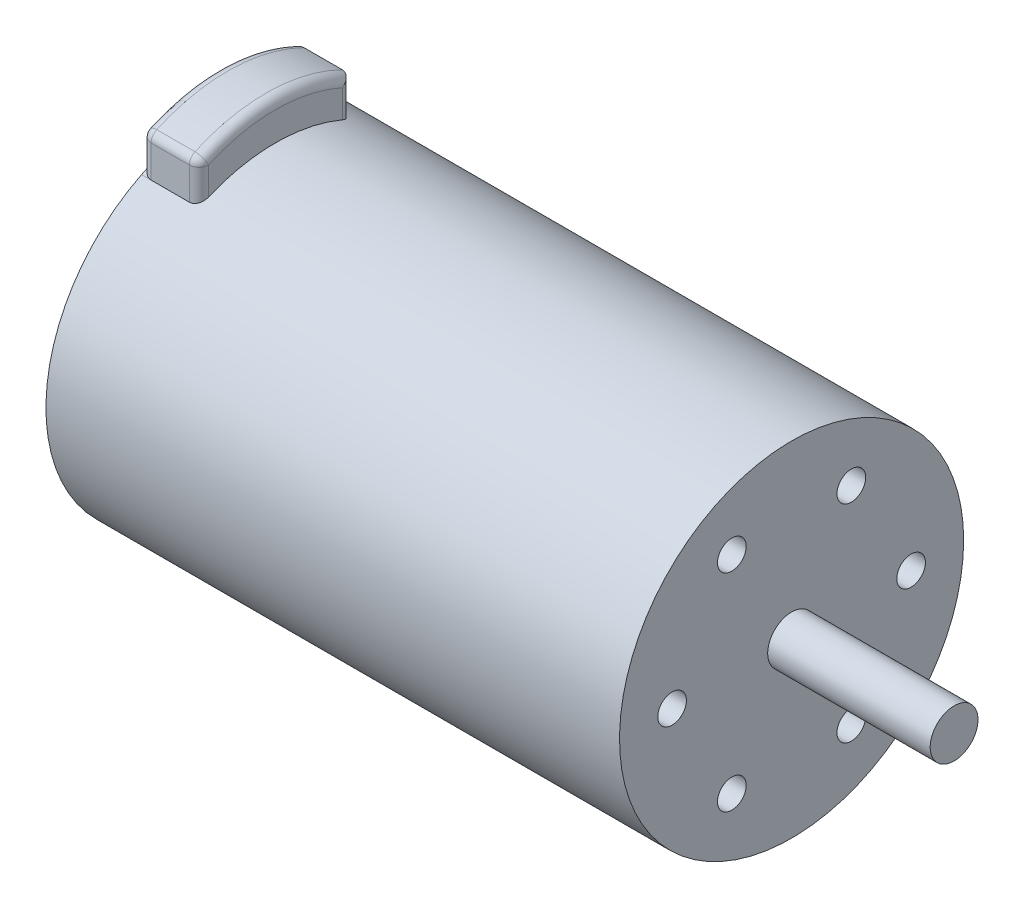
from build123d import *

# Parameters (mm, degrees)
SKETCH1_R           = 18
BOSS_EXTRUDE1_DEPTH = 60
SKETCH2_R           = 2.5
BOSS_EXTRUDE2_DEPTH = 17
SKETCH3_R           = 1.5
CUT_EXTRUDE1_DEPTH  = 5
BOSS_EXTRUDE3_DEPTH = 6
FILLET1_R           = 1


with BuildPart() as part:
    # Sketch1 → Boss-Extrude1 (new body)
    with BuildSketch(Plane(origin=(0, 0, 0), x_dir=(0, 0, -1), z_dir=(1, 0, 0))):
        Circle(SKETCH1_R)
    extrude(amount=BOSS_EXTRUDE1_DEPTH)

    # Sketch2 → Boss-Extrude2 (add)
    with BuildSketch(Plane(origin=(60, 0, 0), x_dir=(0, 0, -1), z_dir=(1, 0, 0))):
        Circle(SKETCH2_R)
    extrude(amount=BOSS_EXTRUDE2_DEPTH)

    # Sketch3 → Cut-Extrude1 (cut)
    with BuildSketch(Plane(origin=(60, 0, 0), x_dir=(0, 0, -1), z_dir=(1, 0, 0))):
        with Locations((12.5, 0)):
            Circle(SKETCH3_R)
        with Locations((6.25, -10.825317547)):
            Circle(SKETCH3_R)
        with Locations((-6.25, -10.825317547)):
            Circle(SKETCH3_R)
        with Locations((-12.5, 0)):
            Circle(SKETCH3_R)
        with Locations((-6.25, 10.825317547)):
            Circle(SKETCH3_R)
        with Locations((6.25, 10.825317547)):
            Circle(SKETCH3_R)
    extrude(amount=-CUT_EXTRUDE1_DEPTH, mode=Mode.SUBTRACT)

    # Sketch4 → Boss-Extrude3 (add)
    with BuildSketch(Plane.ZY):
        with BuildLine():
            Line((-8, 16.124515497), (-8, 20.124515497))
            ThreePointArc((-8, 20.124515497), (0, 22), (8, 20.124515497))
            Line((8, 20.124515497), (8, 16.124515497))
            ThreePointArc((8, 16.124515497), (0, 18), (-8, 16.124515497))
        make_face()
    extrude(amount=-BOSS_EXTRUDE3_DEPTH)

    # Fillet1
    fillet1_edges = [part.edges().sort_by_distance(p)[0] for p in [
        (6, 18.124515497, -8),
        (6, 22, 0),
        (6, 18.124515497, 8),
        (3, 20.124515497, 8),
        (0, 18.124515497, 8),
        (0, 22, 0),
        (0, 18.124515497, -8),
    ]]
    fillet(fillet1_edges, radius=FILLET1_R)


solid = part.part
